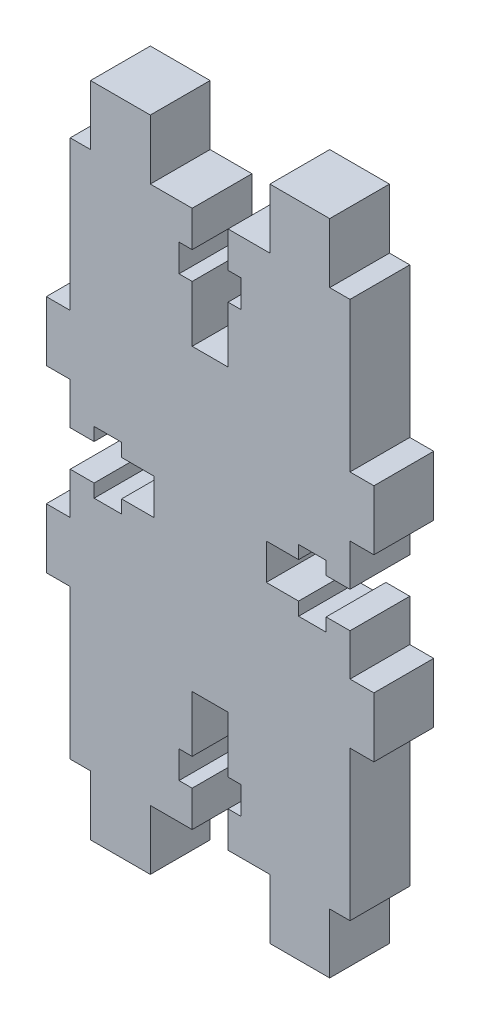
from build123d import *

# Parameters (mm, degrees)
BOSS_EXTRU_1_DEPTH = 5


with BuildPart() as part:
    # Esquisse1 → Boss.-Extru.1 (new body)
    with BuildSketch(Plane.XY):
        Polygon((1.7, 50), (1.7, 45), (0, 45), (0, 32.5), (-2, 32.5), (-2, 27.5), (0, 27.5), (0, 24), (2, 24), (2, 25.1), (4.3, 25.1), (4.3, 24), (7, 24), (7, 21), (4.3, 21), (4.3, 19.9), (2, 19.9), (2, 21), (0, 21), (0, 17.5), (-2, 17.5), (-2, 12.5), (0, 12.5), (0, 0), (1.7, 0), (1.7, -5), (6.7, -5), (6.7, 0), (10.2, 0), (10.2, 3), (9.1, 3), (9.1, 5.3), (10.2, 5.3), (10.2, 10), (13.2, 10), (13.2, 5.3), (14.3, 5.3), (14.3, 3), (13.2, 3), (13.2, 0), (16.7, 0), (16.7, -5), (21.7, -5), (21.7, 0), (23.4, 0), (23.4, 12.5), (25.4, 12.5), (25.4, 17.5), (23.4, 17.5), (23.4, 21), (21.4, 21), (21.4, 19.9), (19.1, 19.9), (19.1, 21), (16.4, 21), (16.4, 24), (19.1, 24), (19.1, 25.1), (21.4, 25.1), (21.4, 24), (23.4, 24), (23.4, 27.5), (25.4, 27.5), (25.4, 32.5), (23.4, 32.5), (23.4, 45), (21.7, 45), (21.7, 50), (16.7, 50), (16.7, 45), (13.2, 45), (13.2, 42), (14.3, 42), (14.3, 39.7), (13.2, 39.7), (13.2, 35), (10.2, 35), (10.2, 39.7), (9.1, 39.7), (9.1, 42), (10.2, 42), (10.2, 45), (6.7, 45), (6.7, 50), align=None)
    extrude(amount=BOSS_EXTRU_1_DEPTH)


solid = part.part
